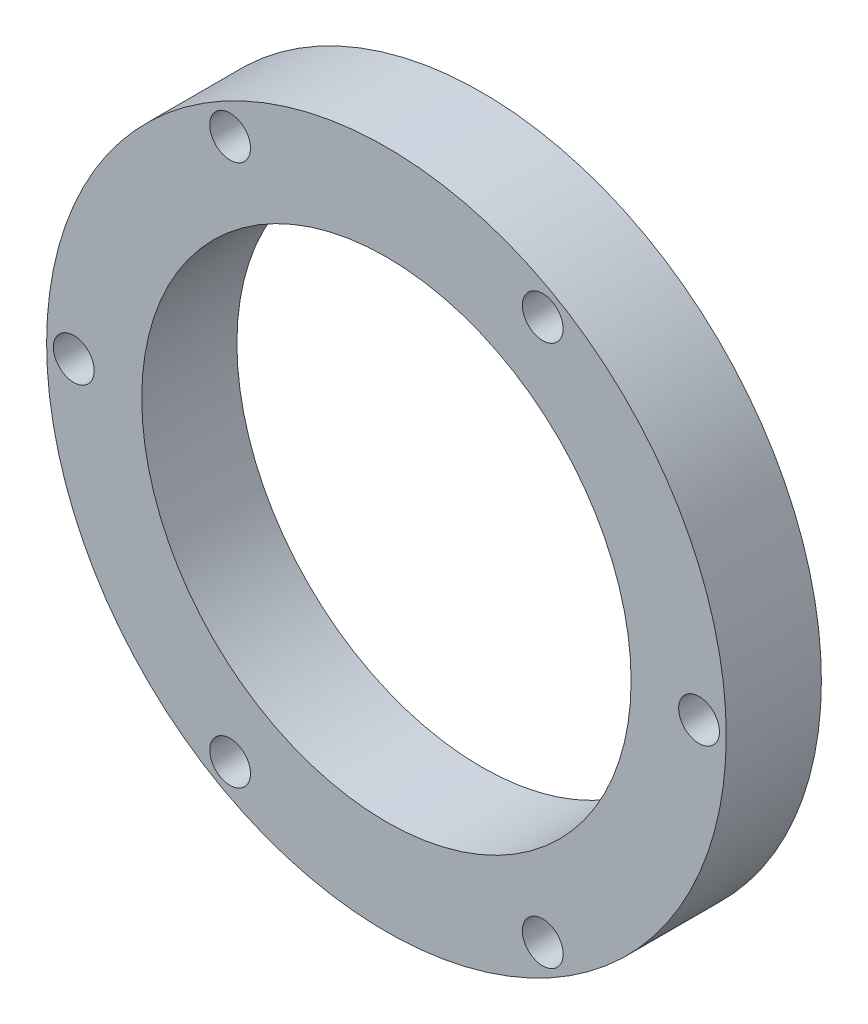
from build123d import *

# Parameters (mm, degrees)
SKETCH1_R           = 25
SKETCH1_R_2         = 18
SKETCH1_R_3         = 1.5
BOSS_EXTRUDE1_DEPTH = 7


with BuildPart() as part:
    # Sketch1 → Boss-Extrude1 (new body)
    with BuildSketch(Plane.XY):
        Circle(SKETCH1_R)
        Circle(SKETCH1_R_2, mode=Mode.SUBTRACT)
        with Locations((-11.5, 19.918584287)):
            Circle(SKETCH1_R_3, mode=Mode.SUBTRACT)
        with Locations((-23, 0)):
            Circle(SKETCH1_R_3, mode=Mode.SUBTRACT)
        with Locations((-11.5, -19.918584287)):
            Circle(SKETCH1_R_3, mode=Mode.SUBTRACT)
        with Locations((11.5, -19.918584287)):
            Circle(SKETCH1_R_3, mode=Mode.SUBTRACT)
        with Locations((23, 0)):
            Circle(SKETCH1_R_3, mode=Mode.SUBTRACT)
        with Locations((11.5, 19.918584287)):
            Circle(SKETCH1_R_3, mode=Mode.SUBTRACT)
    extrude(amount=BOSS_EXTRUDE1_DEPTH)


solid = part.part
